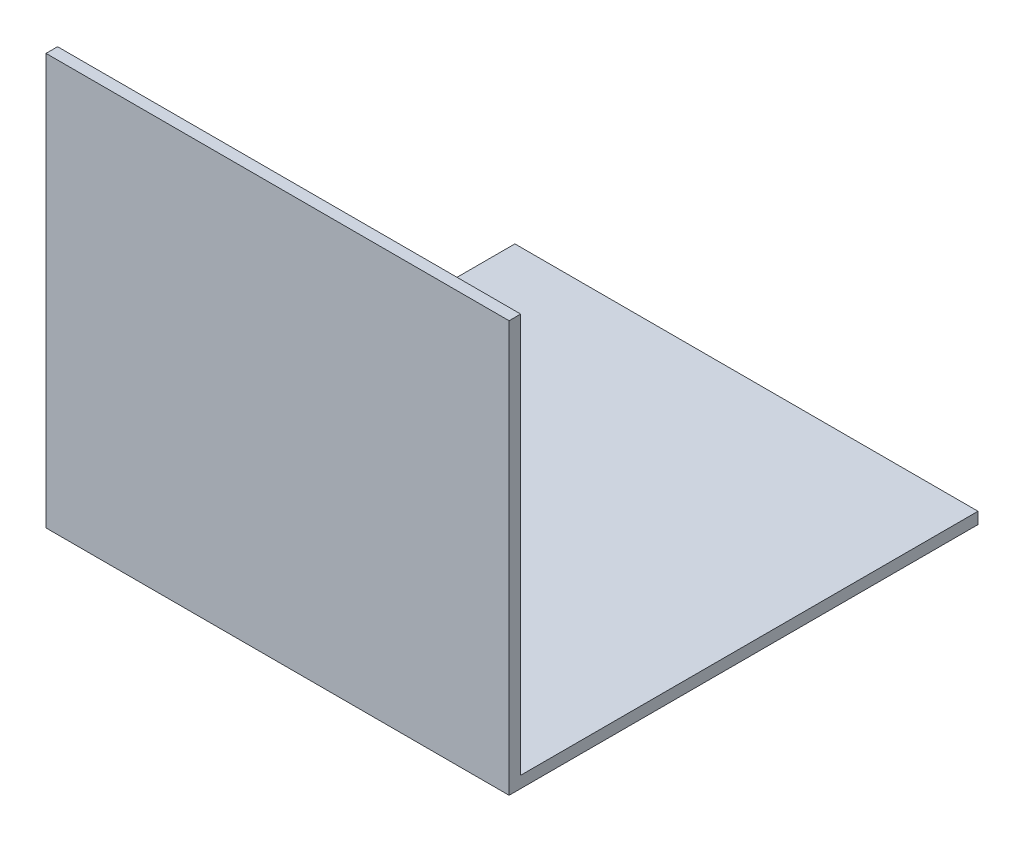
from build123d import *

# Parameters (mm, degrees)
EXTRUDE_THIN1_DEPTH = 800


with BuildPart() as part:
    # Sketch2 → Extrude-Thin1 (new body)
    with BuildSketch(Plane(origin=(0, 0, 0), x_dir=(0, 0, -1), z_dir=(1, 0, 0))):
        Polygon((-10, 700), (-10, -10), (800, -10), (800, 10), (10, 10), (10, 700), align=None)
    extrude(amount=EXTRUDE_THIN1_DEPTH)


solid = part.part
